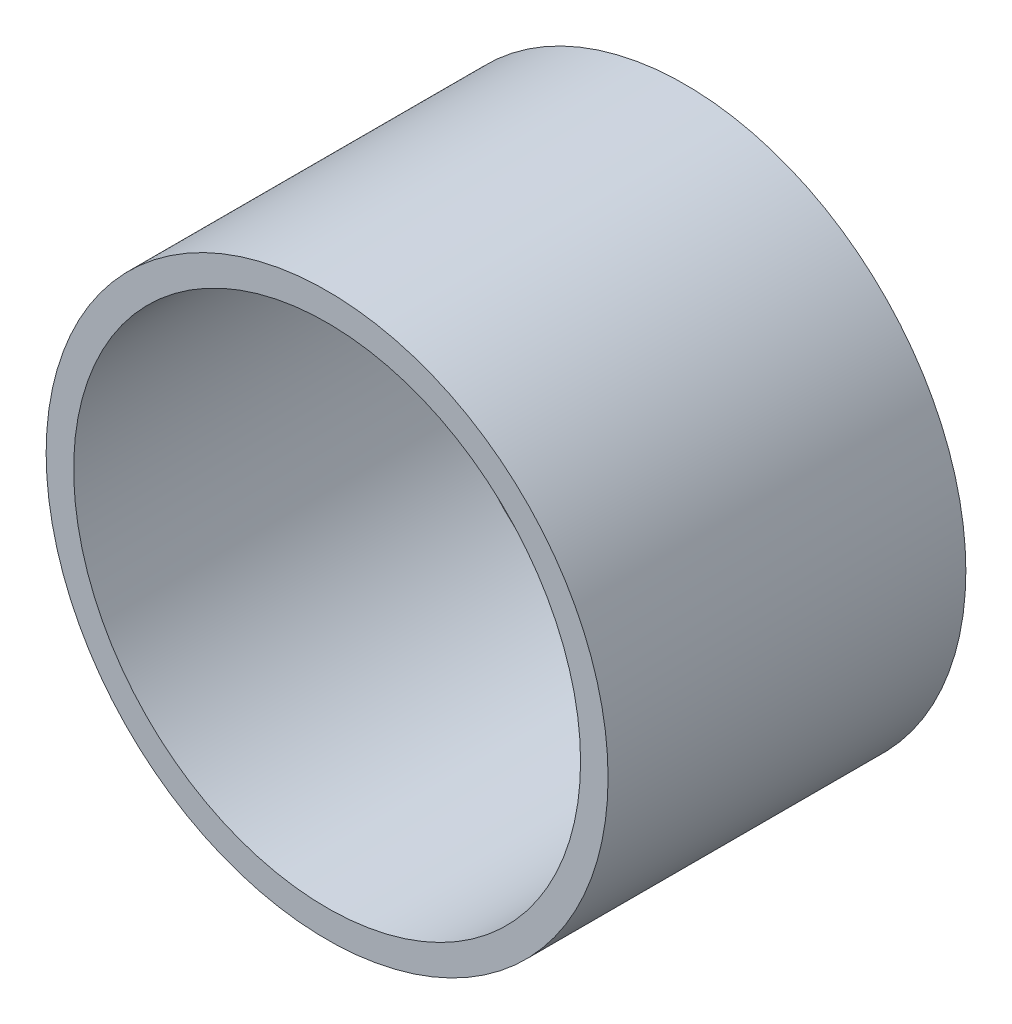
from build123d import *

# Parameters (mm, degrees)
SKETCH1_R           = 6.096
BOSS_EXTRUDE1_DEPTH = 7.762399691
SKETCH4_R           = 5.4991
CUT_EXTRUDE1_DEPTH  = 14.346010364


with BuildPart() as part:
    # Sketch1 → Boss-Extrude1 (new body)
    with BuildSketch(Plane.XY):
        Circle(SKETCH1_R)
    extrude(amount=BOSS_EXTRUDE1_DEPTH)

    # Sketch4 → Cut-Extrude1 (cut)
    with BuildSketch(Plane.XY.offset(7.762399691)):
        Circle(SKETCH4_R)
    extrude(amount=-CUT_EXTRUDE1_DEPTH, mode=Mode.SUBTRACT)


solid = part.part
